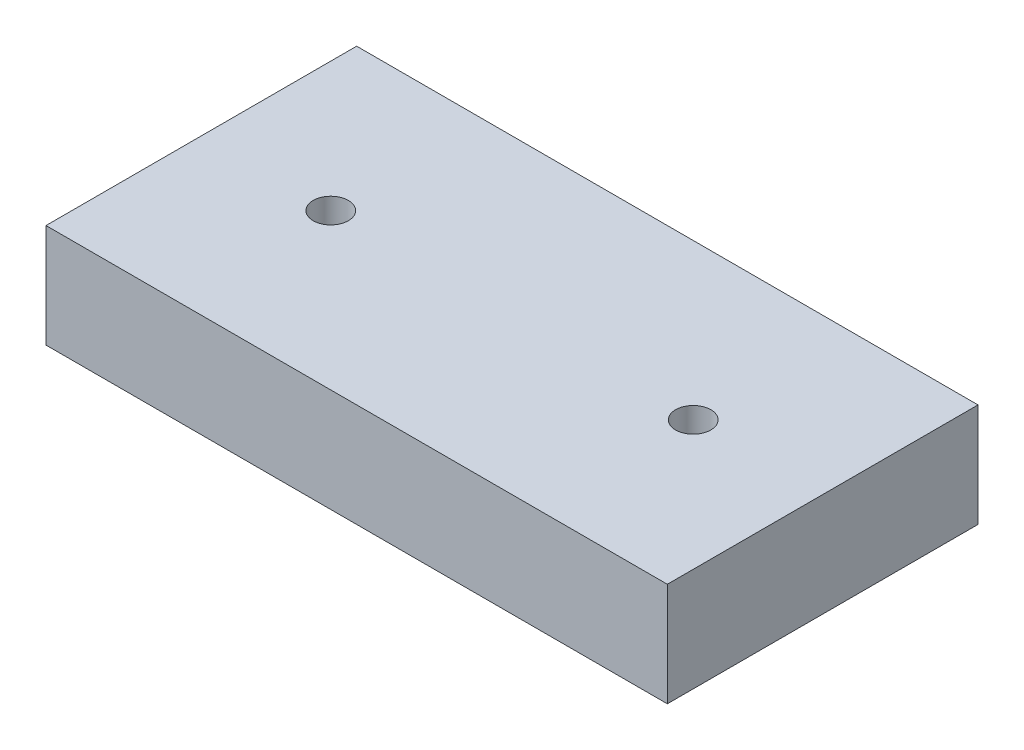
from build123d import *

# Parameters (mm, degrees)
SKETCH1_W           = 120
SKETCH1_H           = 60
BOSS_EXTRUDE1_DEPTH = 20
M8_TAPPED_HOLE2_D   = 6.8


with BuildPart() as part:
    # Sketch1 → Boss-Extrude1 (new body)
    with BuildSketch(Plane(origin=(0, 0, 0), x_dir=(1, 0, 0), z_dir=(0, 1, 0))):
        Rectangle(SKETCH1_W, SKETCH1_H)
    extrude(amount=BOSS_EXTRUDE1_DEPTH)

    # M8 Tapped Hole2 (through all)
    with Locations(Plane(origin=(-35, 20, 0), x_dir=(0, 0, 1), z_dir=(0, 1, 0))):
        with Locations((0, 0), (0, 70)):
            Hole(M8_TAPPED_HOLE2_D / 2)


solid = part.part
